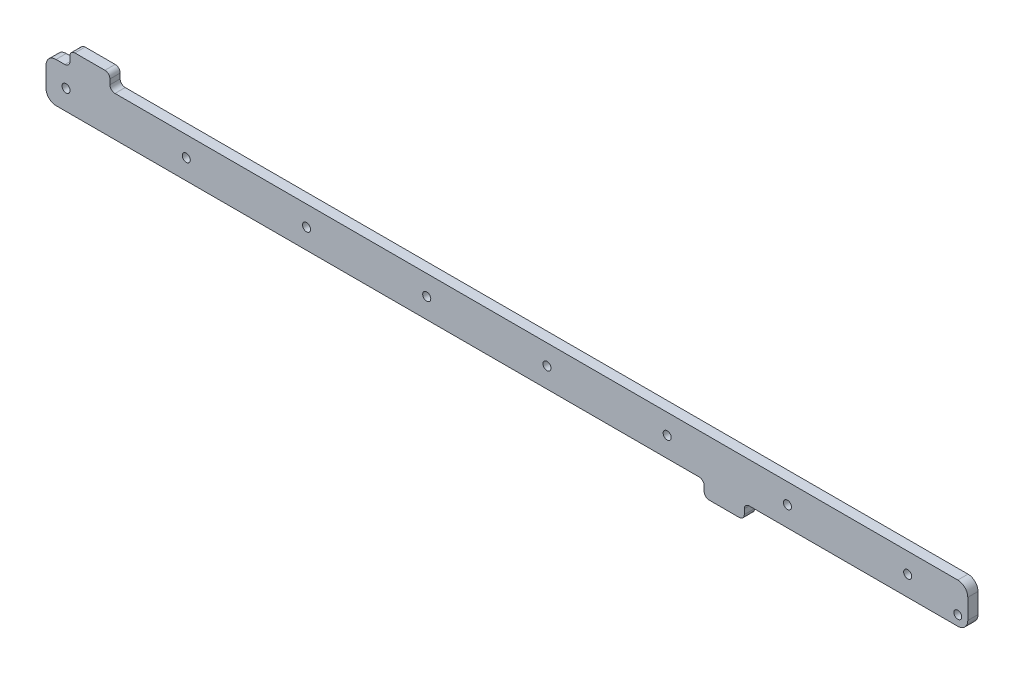
from build123d import *

# Parameters (mm, degrees)
SKETCH1_R                                          = 2.4892
BOSS_EXTRUDE1_DEPTH                                = 6.477
FILLET2_R                                          = 6.35
CSK_FOR_10_FLAT_HEAD_MACHINE_SCREW_100_D           = 5.1054
CSK_FOR_10_FLAT_HEAD_MACHINE_SCREW_100_CSINK_D     = 9.779
CSK_FOR_10_FLAT_HEAD_MACHINE_SCREW_100_CSINK_ANGLE = 100
LPATTERN1_COUNT                                    = 8
LPATTERN1_PITCH                                    = 76.2
FILLET3_R                                          = 3.175


with BuildPart() as part:
    # Sketch1 → Boss-Extrude1 (new body)
    with BuildSketch(Plane.XY):
        Polygon((0, 0), (40.53078, 0), (417.140898, 0), (417.140898, -9.525), (442.540898, -9.525), (442.540898, 0), (584.2, 0), (584.2, 25.4), (40.53078, 25.4), (40.53078, 34.925), (15.13078, 34.925), (15.13078, 25.4), (0, 25.4), align=None)
        with Locations((577.85, 6.35)):
            Circle(SKETCH1_R, mode=Mode.SUBTRACT)
    extrude(amount=BOSS_EXTRUDE1_DEPTH)

    # Fillet2
    fillet2_edges = [part.edges().sort_by_distance(p)[0] for p in [
        (0, 0, 3.2385),
        (0, 25.4, 3.2385),
        (584.2, 25.4, 3.2385),
        (584.2, 0, 3.2385),
    ]]
    fillet(fillet2_edges, radius=FILLET2_R)

    # CSK for #10 Flat Head Machine Screw (100)1 (through all)
    with Locations(Plane.XY.offset(6.477)):
        with Locations((546.1, 12.7)):
            csk_for_10_flat_head_machine_screw_100 = CounterSinkHole(CSK_FOR_10_FLAT_HEAD_MACHINE_SCREW_100_D / 2, CSK_FOR_10_FLAT_HEAD_MACHINE_SCREW_100_CSINK_D / 2, counter_sink_angle=CSK_FOR_10_FLAT_HEAD_MACHINE_SCREW_100_CSINK_ANGLE)

    # LPattern1: CSK for #10 Flat Head Machine Screw (100)1 ×8
    with Locations(*[(-i * LPATTERN1_PITCH, 0, 0) for i in range(1, LPATTERN1_COUNT)]):
        add(csk_for_10_flat_head_machine_screw_100, mode=Mode.SUBTRACT)


with BuildPart() as body_2:
    # Mirror2: mirrored copy
    add(part.part.mirror(Plane.XY))

    # Fillet3
    fillet3_edges = [body_2.edges().sort_by_distance(p)[0] for p in [
        (442.540898, -9.525, -3.2385),
        (417.140898, -9.525, -3.2385),
        (417.140898, 0, -3.2385),
        (15.13078, 25.4, -3.2385),
        (15.13078, 34.925, -3.2385),
        (40.53078, 34.925, -3.2385),
        (40.53078, 25.4, -3.2385),
        (442.540898, 0, -3.2385),
    ]]
    fillet(fillet3_edges, radius=FILLET3_R)


solid = body_2.part
